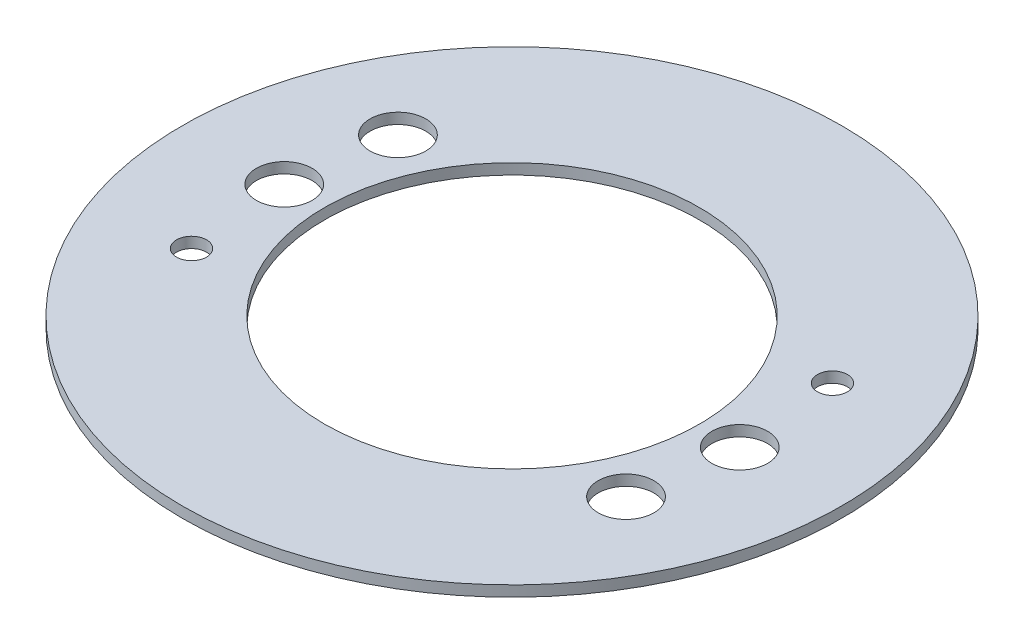
from build123d import *

# Parameters (mm, degrees)
SKETCH1_R           = 78.105
SKETCH1_R_2         = 44.45
BOSS_EXTRUDE1_DEPTH = 2.54
SKETCH2_R           = 6.604
SKETCH2_R_2         = 3.556
CUT_EXTRUDE1_DEPTH  = 2.54


with BuildPart() as part:
    # Sketch1 → Boss-Extrude1 (new body)
    with BuildSketch(Plane(origin=(0, 0, 0), x_dir=(1, 0, 0), z_dir=(0, 1, 0))):
        with Locations(Location((0, 0, 0), (0, 0, 270))):
            Circle(SKETCH1_R)
        with Locations(Location((0, 0, 0), (0, 0, 270))):
            Circle(SKETCH1_R_2, mode=Mode.SUBTRACT)
    extrude(amount=BOSS_EXTRUDE1_DEPTH)

    # Sketch2 → Cut-Extrude1 (cut)
    with BuildSketch(Plane(origin=(0, 2.54, 0), x_dir=(1, 0, 0), z_dir=(0, 1, 0))):
        with Locations(Location((-53.975, 0, 0), (0, 0, 270))):
            Circle(SKETCH2_R)
        with Locations(Location((53.975, 0, 0), (0, 0, 270))):
            Circle(SKETCH2_R)
        with Locations(Location((-51.795490029, -24.152633658, 0), (0, 0, 270))):
            Circle(SKETCH2_R_2)
        with Locations(Location((51.795490029, 24.152633658, 0), (0, 0, 270))):
            Circle(SKETCH2_R_2)
        with Locations(Location((50.64447914, -23.615908466, 0), (0, 0, 270))):
            Circle(SKETCH2_R)
        with Locations(Location((-50.64447914, 23.615908466, 0), (0, 0, 270))):
            Circle(SKETCH2_R)
    extrude(amount=-CUT_EXTRUDE1_DEPTH, mode=Mode.SUBTRACT)


solid = part.part
